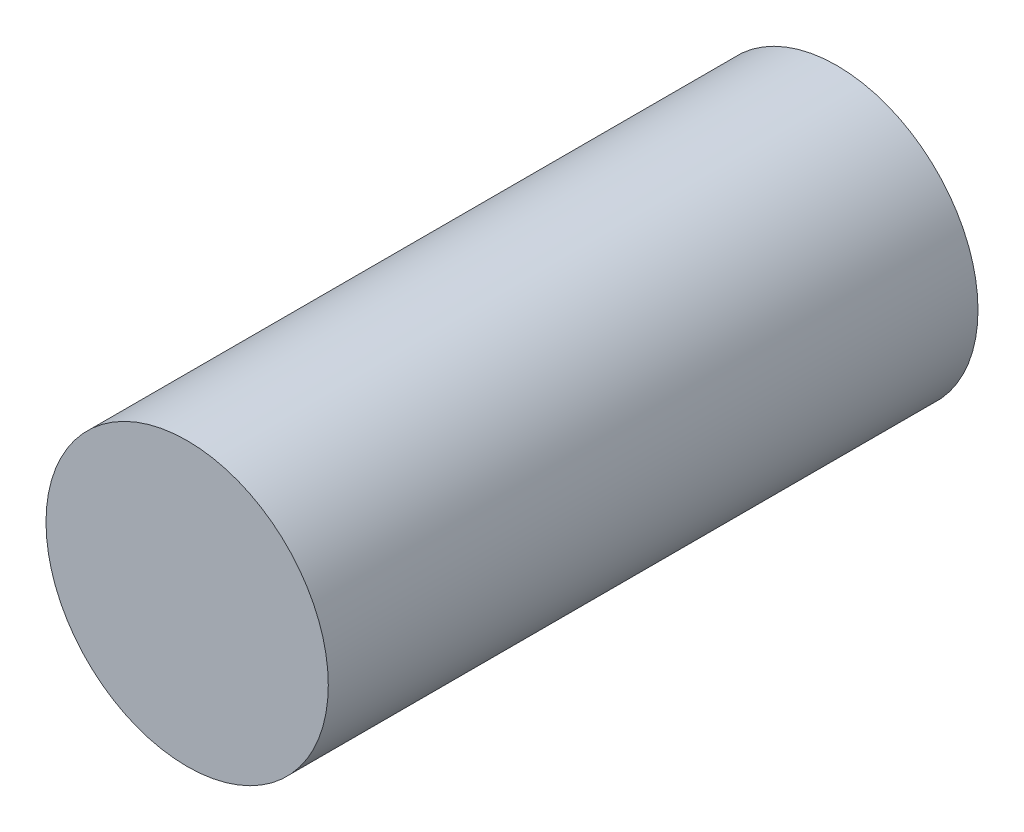
from build123d import *

# Parameters (mm, degrees)
SKETCH3_R           = 8.907418597
BOSS_EXTRUDE1_DEPTH = 41


with BuildPart() as part:
    # Sketch3 → Boss-Extrude1 (new body)
    with BuildSketch(Plane(origin=(0, 0, 0), x_dir=(0, 1, 0), z_dir=(0, 0, 1))):
        with Locations(Location((0, 0, 0), (0, 0, 270))):
            Circle(SKETCH3_R)
    extrude(amount=BOSS_EXTRUDE1_DEPTH)


solid = part.part
